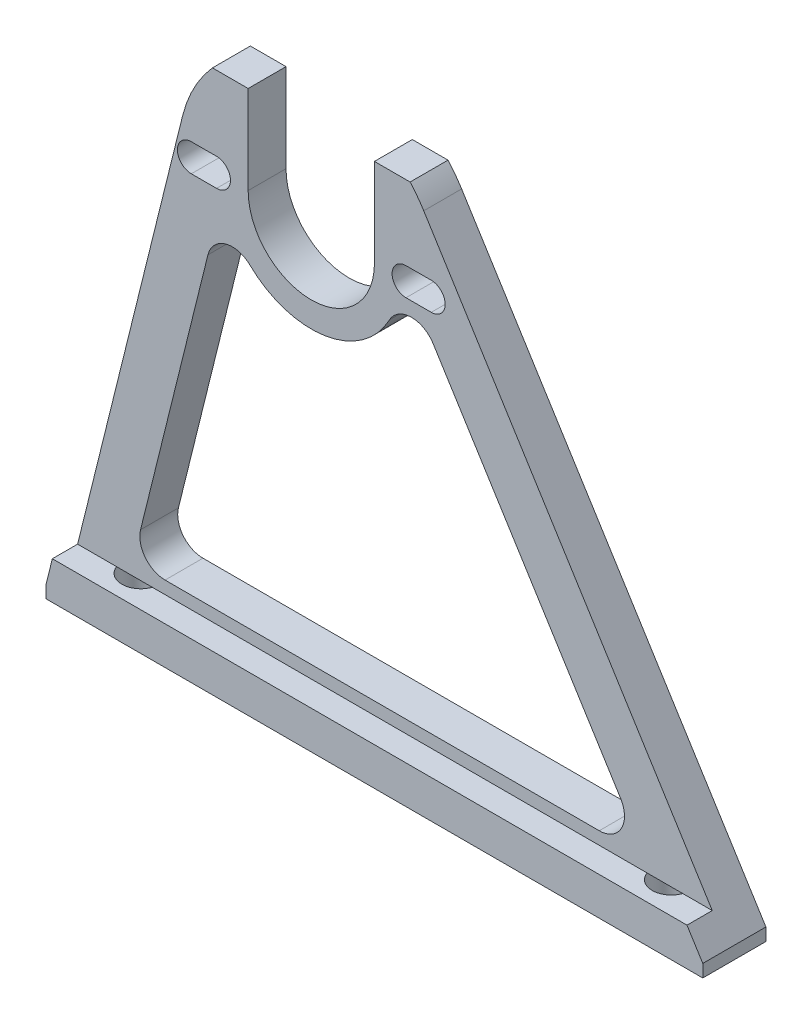
from build123d import *

# Parameters (mm, degrees)
EXTRUDE_1_DEPTH     = 5
SKETCH_2_W          = 105.590665855
SKETCH_2_H          = 53.734325109
CUT_EXTRUDE_1_DEPTH = 2
SKETCH_4_R          = 1.5
CUT_EXTRUDE_2_DEPTH = 3


with BuildPart() as part:
    # 草图1 → 凸台-拉伸1 (new body)
    with BuildSketch(Plane.XY):
        with BuildLine():
            Line((-10.191413347, 2.526874351), (-19, -33))
            Line((-19, -33), (-19, -34))
            Line((-19, -34), (33, -34))
            Line((33, -34), (33, -33))
            Line((33, -33), (8.904718959, 5.563809869))
            ThreePointArc((8.904718959, 5.563809869), (8.396242616, 6.305006736), (7.826237921, 7))
            Line((7.826237921, 7), (5, 7))
            Line((5, 7), (5, 0))
            ThreePointArc((5, 0), (0, -5), (-5, 0))
            Line((-5, 0), (-5, 7))
            Line((-5, 7), (-7.826237921, 7))
            ThreePointArc((-7.826237921, 7), (-9.282303193, 4.908039061), (-10.191413347, 2.526874351))
        make_face()
        with BuildLine():
            Line((-8.452697078, -7.081843943), (-13.519839571, -27.5186906))
            ThreePointArc((-13.519839571, -27.5186906), (-13.153835237, -29.232351654), (-11.578617982, -30))
            Line((-11.578617982, -30), (22.801020138, -30))
            ThreePointArc((22.801020138, -30), (24.55024091, -28.969652872), (24.497157083, -26.940226692))
            Line((24.497157083, -26.940226692), (9.642502803, -3.165776319))
            ThreePointArc((9.642502803, -3.165776319), (7.876643723, -2.22676529), (6.180506778, -3.286538599))
            ThreePointArc((6.180506778, -3.286538599), (1.099422059, -6.91312311), (-4.856029369, -5.041723789))
            ThreePointArc((-4.856029369, -5.041723789), (-6.797250959, -4.560414389), (-8.184687922, -6.0009069))
            Line((-8.184687922, -6.0009069), (-8.452697078, -7.081843943))
        make_face(mode=Mode.SUBTRACT)
        with BuildLine():
            Line((-9.5, 1.1), (-7.5, 1.1))
            ThreePointArc((-7.5, 1.1), (-6.4, 0), (-7.5, -1.1))
            Line((-7.5, -1.1), (-9.5, -1.1))
            ThreePointArc((-9.5, -1.1), (-10.6, 0), (-9.5, 1.1))
        make_face(mode=Mode.SUBTRACT)
        with BuildLine():
            Line((9.5, -1.1), (7.5, -1.1))
            ThreePointArc((7.5, -1.1), (6.4, 0), (7.5, 1.1))
            Line((7.5, 1.1), (9.5, 1.1))
            ThreePointArc((9.5, 1.1), (10.6, 0), (9.5, -1.1))
        make_face(mode=Mode.SUBTRACT)
    extrude(amount=EXTRUDE_1_DEPTH)

    # 草图2 → 切除-拉伸1 (cut)
    with BuildSketch(Plane.XY.offset(5)):
        with Locations((1.500851151, -4.132837446)):
            Rectangle(SKETCH_2_W, SKETCH_2_H)
    extrude(amount=-CUT_EXTRUDE_1_DEPTH, mode=Mode.SUBTRACT)

    # 草图4 → 切除-拉伸2 (cut)
    with BuildSketch(Plane(origin=(0, -34, 0), x_dir=(-1, 0, 0), z_dir=(0, -1, 0))):
        with Locations(Location((14, -2.5, 0), (0, 0, 90))):
            Circle(SKETCH_4_R)
        with Locations(Location((-28, -2.5, 0), (0, 0, 90))):
            Circle(SKETCH_4_R)
    extrude(amount=-CUT_EXTRUDE_2_DEPTH, mode=Mode.SUBTRACT)


solid = part.part
